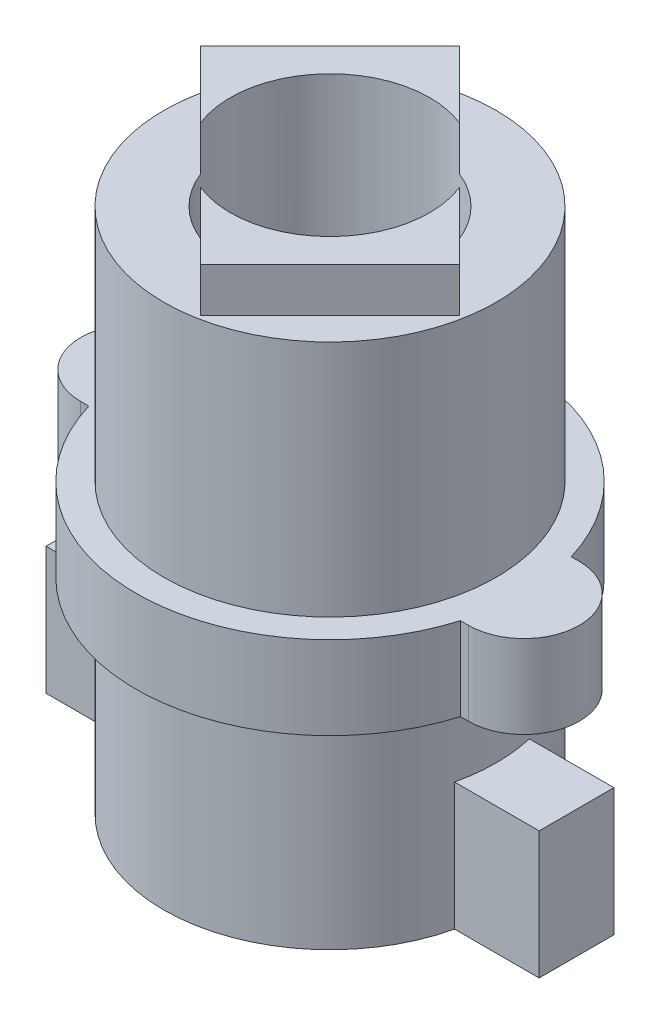
from build123d import *

# Parameters (mm, degrees)
SKETCH_1_W          = 17.8
SKETCH_1_H          = 2.7
EXTRUDE_1_DEPTH     = 4.6
SKETCH_2_R          = 6
EXTRUDE_2_DEPTH     = 19
EXTRUDE_3_DEPTH     = 1.6
BOSS_EXTRUDE2_DEPTH = 3
SKETCH_6_R          = 3.6
CUT_EXTRUDE2_DEPTH  = 24.544850817


with BuildPart() as part:
    # 草图1 → 凸台-拉伸1 (new body)
    with BuildSketch(Plane(origin=(0, 0, 0), x_dir=(1, 0, 0), z_dir=(0, 1, 0))):
        Rectangle(SKETCH_1_W, SKETCH_1_H)
    extrude(amount=EXTRUDE_1_DEPTH)

    # 草图2 → 凸台-拉伸2 (add)
    with BuildSketch(Plane(origin=(0, 0, 0), x_dir=(-1, 0, 0), z_dir=(0, -1, 0))):
        with Locations(Location((0, 0, 0), (0, 0, 90))):
            Circle(SKETCH_2_R)
    extrude(amount=-EXTRUDE_2_DEPTH)

    # 草图4 → 凸台-拉伸3 (add)
    with BuildSketch(Plane(origin=(0, 19, 0), x_dir=(1, 0, 0), z_dir=(0, 1, 0))):
        Polygon((-5.747717471, 1.077984288), (-3.323048318, -1.346684865), (1.346684865, 3.323048318), (-1.077984288, 5.747717471), align=None)
        Polygon((-1.346684865, -3.323048318), (1.077984288, -5.747717471), (5.747717471, -1.077984288), (3.323048318, 1.346684865), align=None)
    extrude(amount=EXTRUDE_3_DEPTH)

    # Sketch4 → Boss-Extrude2 (add)
    with BuildSketch(Plane(origin=(0, 7.4, 0), x_dir=(1, 0, 0), z_dir=(0, 1, 0))):
        with BuildLine():
            ThreePointArc((6.708203932, 2), (0, 7), (-6.708203932, 2))
            Line((-6.708203932, 2), (6.708203932, 2))
        make_face()
        with BuildLine():
            ThreePointArc((-6.708203932, 2), (-6.926666858, 1.010587075), (-7, 0))
            Line((-7, 0), (7, 0))
            ThreePointArc((7, 0), (6.926666858, 1.010587075), (6.708203932, 2))
            Line((6.708203932, 2), (-6.708203932, 2))
        make_face()
        with BuildLine():
            ThreePointArc((-6.708203932, -2), (-6.926666858, -1.010587075), (-7, 0))
            ThreePointArc((-7, 0), (-6.926666858, 1.010587075), (-6.708203932, 2))
            Line((-6.708203932, 2), (-7, 2))
            ThreePointArc((-7, 2), (-9, 0), (-7, -2))
            Line((-7, -2), (-6.708203932, -2))
        make_face()
        with BuildLine():
            Line((7, 0), (-7, 0))
            ThreePointArc((-7, 0), (-6.926666858, -1.010587075), (-6.708203932, -2))
            Line((-6.708203932, -2), (6.708203932, -2))
            ThreePointArc((6.708203932, -2), (6.926666858, -1.010587075), (7, 0))
        make_face()
        with BuildLine():
            Line((6.708203932, -2), (-6.708203932, -2))
            ThreePointArc((-6.708203932, -2), (0, -7), (6.708203932, -2))
        make_face()
        with BuildLine():
            ThreePointArc((6.708203932, 2), (6.926666858, 1.010587075), (7, 0))
            ThreePointArc((7, 0), (6.926666858, -1.010587075), (6.708203932, -2))
            Line((6.708203932, -2), (7, -2))
            ThreePointArc((7, -2), (9, 0), (7, 2))
            Line((7, 2), (6.708203932, 2))
        make_face()
    extrude(amount=BOSS_EXTRUDE2_DEPTH)

    # 草图6 → Cut-Extrude2 (cut, through all)
    with BuildSketch(Plane.XZ):
        with Locations(Location((0, 0, 0), (0, 0, 270))):
            Circle(SKETCH_6_R)
    extrude(amount=-CUT_EXTRUDE2_DEPTH, mode=Mode.SUBTRACT)


solid = part.part
